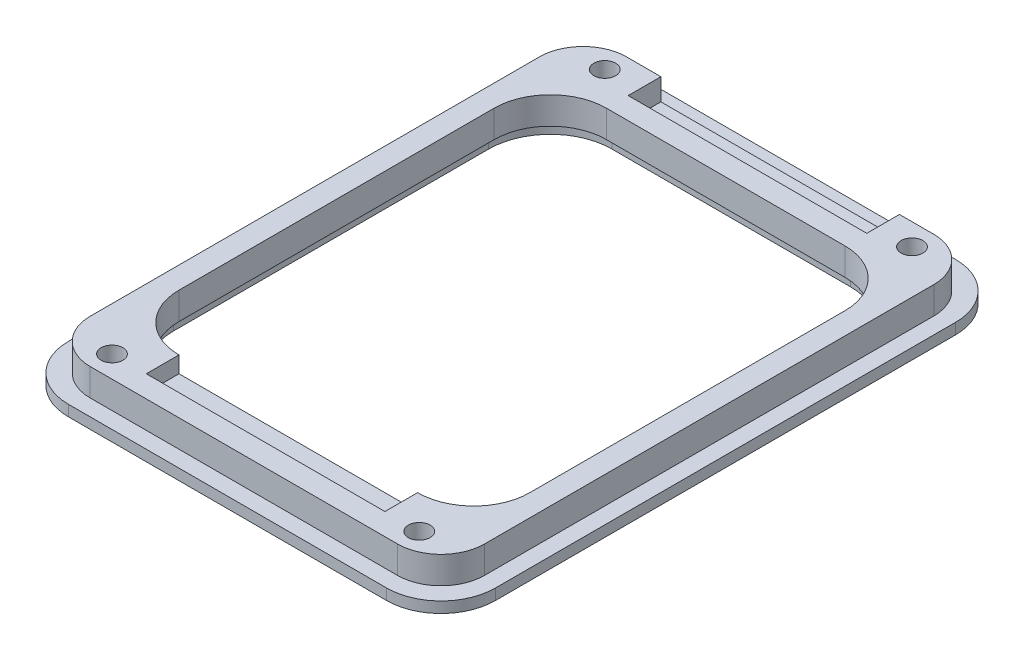
from build123d import *

# Parameters (mm, degrees)
EXTRUDE_1_DEPTH       = 2.5
SKETCH_1_3_W          = 21.9
SKETCH_1_3_H          = 3
EXTRUDE_2_DEPTH       = 0.5
SKETCH_2_R            = 1
CUT_EXTRUDE_1_DEPTH   = 34.660057049
SKETCH_3_W            = 21.9
SKETCH_3_H            = 3
CUT_EXTRUDE_2_DEPTH   = 1.5
SKETCH_4_W            = 39.2
SKETCH_4_H            = 52.23
EXTRUDE_3_DEPTH       = 1
CUT_EXTRUDE_START     = -1
CUT_EXTRUDE_3_DEPTH   = 1
FILLET_1_R            = 4
CUT_EXTRUDE_1_2_DEPTH = 1
FILLET_2_R            = 5


with BuildPart() as part:
    # 草图1 → 凸台-拉伸1 (new body)
    with BuildSketch(Plane(origin=(0, 0, 0), x_dir=(1, 0, 0), z_dir=(0, 1, 0))):
        Polygon((20.308319986, -22.503204833), (20.308319986, 26.726795167), (13.158319986, 26.726795167), (13.158319986, 23.726795167), (-8.741680014, 23.726795167), (-8.741680014, 26.726795167), (-15.891680014, 26.726795167), (-15.891680014, -22.503204833), align=None)
        with BuildLine():
            ThreePointArc((18.308319986, -12.353204833), (16.799919909, -15.994804756), (13.158319986, -17.503204833))
            Line((13.158319986, -17.503204833), (-8.741680014, -17.503204833))
            ThreePointArc((-8.741680014, -17.503204833), (-12.383279937, -15.994804756), (-13.891680014, -12.353204833))
            Line((-13.891680014, -12.353204833), (-13.891680014, 16.576795167))
            ThreePointArc((-13.891680014, 16.576795167), (-12.383279937, 20.21839509), (-8.741680014, 21.726795167))
            Line((-8.741680014, 21.726795167), (13.158319986, 21.726795167))
            ThreePointArc((13.158319986, 21.726795167), (16.799919909, 20.21839509), (18.308319986, 16.576795167))
            Line((18.308319986, 16.576795167), (18.308319986, -12.353204833))
        make_face(mode=Mode.SUBTRACT)
    extrude(amount=EXTRUDE_1_DEPTH)

    # 草图1<3> → 凸台-拉伸2 (add)
    with BuildSketch(Plane(origin=(0, 0, 0), x_dir=(1, 0, 0), z_dir=(0, 1, 0))):
        with Locations((2.208319986, 25.226795167)):
            Rectangle(SKETCH_1_3_W, SKETCH_1_3_H)
    extrude(amount=EXTRUDE_2_DEPTH)

    # 草图2 → Cut-Extrude 1 (cut, through all)
    with BuildSketch(Plane.XZ):
        with Locations((-11.891680014, -24.726795167)):
            Circle(SKETCH_2_R)
        with Locations((-11.891680014, 20.503204833)):
            Circle(SKETCH_2_R)
        with Locations((16.308319986, 20.503204833)):
            Circle(SKETCH_2_R)
        with Locations((16.308319986, -24.726795167)):
            Circle(SKETCH_2_R)
    extrude(amount=-CUT_EXTRUDE_1_DEPTH, mode=Mode.SUBTRACT)

    # 草图3 → 切除-拉伸2 (cut)
    with BuildSketch(Plane(origin=(0, 2.5, 0), x_dir=(1, 0, 0), z_dir=(0, 1, 0))):
        with Locations((2.208319986, -19.003204833)):
            Rectangle(SKETCH_3_W, SKETCH_3_H)
    extrude(amount=-CUT_EXTRUDE_2_DEPTH, mode=Mode.SUBTRACT)

    # 草图4 → 凸台-拉伸3 (add)
    with BuildSketch(Plane.XZ):
        with Locations((2.208319986, -2.111795167)):
            Rectangle(SKETCH_4_W, SKETCH_4_H)
    extrude(amount=EXTRUDE_3_DEPTH)

    # 草图5 → 切除-拉伸3 (cut)
    with BuildSketch(Plane(origin=(0, 0, 0), x_dir=(1, 0, 0), z_dir=(0, 1, 0)).offset(CUT_EXTRUDE_START)):
        with BuildLine():
            Line((18.308319986, -12.353204833), (18.308319986, 16.576795167))
            ThreePointArc((18.308319986, 16.576795167), (16.799919909, 20.21839509), (13.158319986, 21.726795167))
            Line((13.158319986, 21.726795167), (-8.741680014, 21.726795167))
            ThreePointArc((-8.741680014, 21.726795167), (-12.383279937, 20.21839509), (-13.891680014, 16.576795167))
            Line((-13.891680014, 16.576795167), (-13.891680014, -12.353204833))
            ThreePointArc((-13.891680014, -12.353204833), (-12.383279937, -15.994804756), (-8.741680014, -17.503204833))
            Line((-8.741680014, -17.503204833), (13.158319986, -17.503204833))
            ThreePointArc((13.158319986, -17.503204833), (16.799919909, -15.994804756), (18.308319986, -12.353204833))
        make_face()
    extrude(amount=CUT_EXTRUDE_3_DEPTH, mode=Mode.SUBTRACT)

    # 圆角1
    fillet_1_edges = [part.edges().sort_by_distance(p)[0] for p in [
        (-15.891680014, 1.25, 22.503204833),
        (-15.891680014, 1.25, -26.726795167),
        (20.308319986, 1.25, -26.726795167),
        (20.308319986, 1.25, 22.503204833),
    ]]
    fillet(fillet_1_edges, radius=FILLET_1_R)

    # 草图5<2> → Cut-Extrude 1 2 (cut)
    with BuildSketch(Plane(origin=(0, 0, 0), x_dir=(1, 0, 0), z_dir=(0, 1, 0)).offset(CUT_EXTRUDE_START)):
        with BuildLine():
            Line((-8.741680014, -18.003204833), (13.158319986, -18.003204833))
            ThreePointArc((13.158319986, -18.003204833), (17.153473299, -16.348358147), (18.808319986, -12.353204833))
            Line((18.808319986, -12.353204833), (18.808319986, 16.576795167))
            ThreePointArc((18.808319986, 16.576795167), (17.153473299, 20.571948481), (13.158319986, 22.226795167))
            Line((13.158319986, 22.226795167), (-8.741680014, 22.226795167))
            ThreePointArc((-8.741680014, 22.226795167), (-12.736833328, 20.571948481), (-14.391680014, 16.576795167))
            Line((-14.391680014, 16.576795167), (-14.391680014, -12.353204833))
            ThreePointArc((-14.391680014, -12.353204833), (-12.736833328, -16.348358147), (-8.741680014, -18.003204833))
        make_face()
        with BuildLine():
            Line((-8.741680014, -17.503204833), (13.158319986, -17.503204833))
            ThreePointArc((13.158319986, -17.503204833), (16.799919909, -15.994804756), (18.308319986, -12.353204833))
            Line((18.308319986, -12.353204833), (18.308319986, 16.576795167))
            ThreePointArc((18.308319986, 16.576795167), (16.799919909, 20.21839509), (13.158319986, 21.726795167))
            Line((13.158319986, 21.726795167), (-8.741680014, 21.726795167))
            ThreePointArc((-8.741680014, 21.726795167), (-12.383279937, 20.21839509), (-13.891680014, 16.576795167))
            Line((-13.891680014, 16.576795167), (-13.891680014, -12.353204833))
            ThreePointArc((-13.891680014, -12.353204833), (-12.383279937, -15.994804756), (-8.741680014, -17.503204833))
        make_face(mode=Mode.SUBTRACT)
    extrude(amount=CUT_EXTRUDE_1_2_DEPTH, mode=Mode.SUBTRACT)

    # 圆角2
    fillet_2_edges = [part.edges().sort_by_distance(p)[0] for p in [
        (21.808319986, -0.5, 24.003204833),
        (21.808319986, -0.5, -28.226795167),
        (-17.391680014, -0.5, -28.226795167),
        (-17.391680014, -0.5, 24.003204833),
    ]]
    fillet(fillet_2_edges, radius=FILLET_2_R)


solid = part.part
